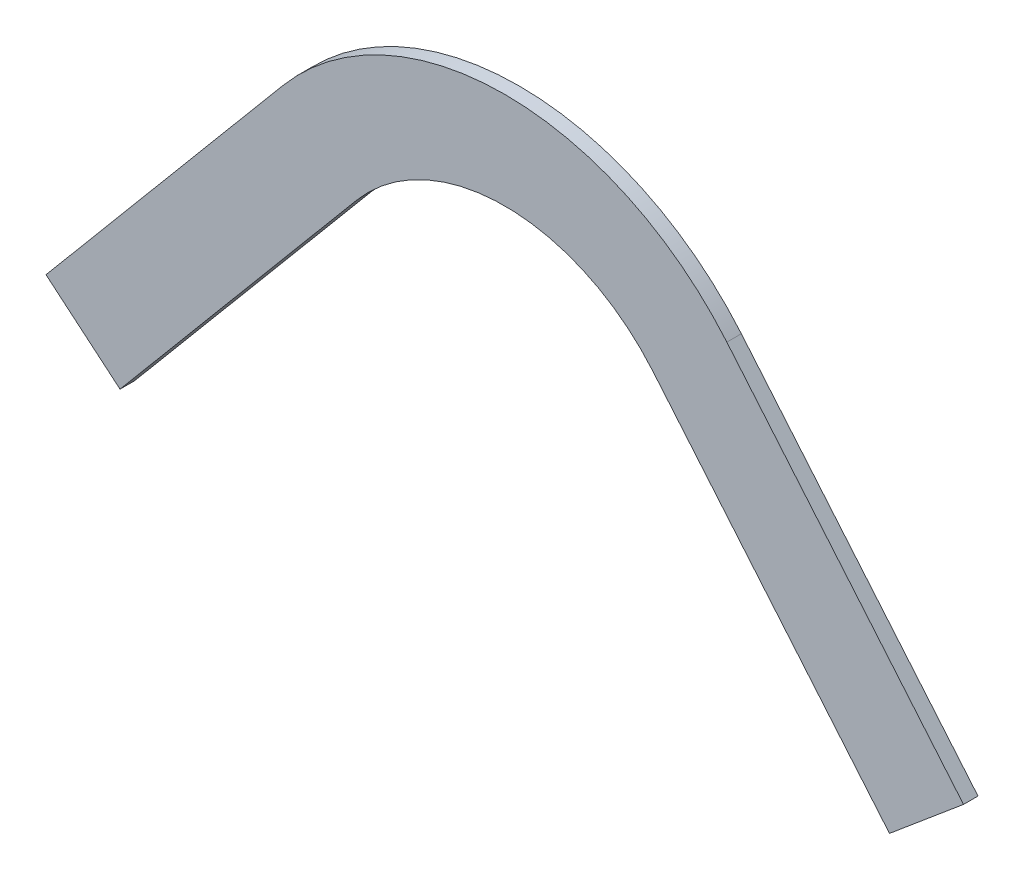
from build123d import *

# Parameters (mm, degrees)
BOSS_EXTRUDE1_DEPTH = 1.5
SKETCH2_W           = 3
SKETCH2_H           = 20
BOSS_EXTRUDE2_DEPTH = 26.2
BOSS_EXTRUDE3_DEPTH = 3


with BuildPart() as part:
    # Sketch1 → Boss-Extrude1 (new, symmetric)
    with BuildSketch(Plane.XY):
        with BuildLine():
            Line((45.962666587, 38.567256581), (30.641777725, 25.711504387))
            ThreePointArc((30.641777725, 25.711504387), (0, 40), (-30.641777725, 25.711504387))
            Line((-30.641777725, 25.711504387), (-45.962666587, 38.567256581))
            ThreePointArc((-45.962666587, 38.567256581), (0, 60), (45.962666587, 38.567256581))
        make_face()
    extrude(amount=BOSS_EXTRUDE1_DEPTH, both=True)

    # Sketch2 → Boss-Extrude2 (add)
    with BuildSketch(Plane(origin=(0, 0, 0), x_dir=(0, 0, 1), z_dir=(-0.6427876096865376, -0.7660444431189795, 0))):
        with Locations((0, 50)):
            Rectangle(SKETCH2_W, SKETCH2_H)
    boss_extrude2 = extrude(amount=BOSS_EXTRUDE2_DEPTH)

    # Mirror1: Boss-Extrude2 across plane
    add(boss_extrude2.mirror(Plane.ZY))

    # Sketch3 → Boss-Extrude3 (add)
    with BuildSketch(Plane(origin=(0, 0, -1.5), x_dir=(-1, 0, 0), z_dir=(0, 0, -1))):
        Polygon((47.482813099, 5.641139978), (62.803701961, 18.496892171), (94.943082445, -19.805329984), (79.622193583, -32.661082178), align=None)
        Polygon((-79.622193583, -32.661082178), (-94.943082445, -19.805329984), (-62.803701961, 18.496892171), (-47.482813099, 5.641139978), align=None)
    extrude(amount=-BOSS_EXTRUDE3_DEPTH)


solid = part.part
